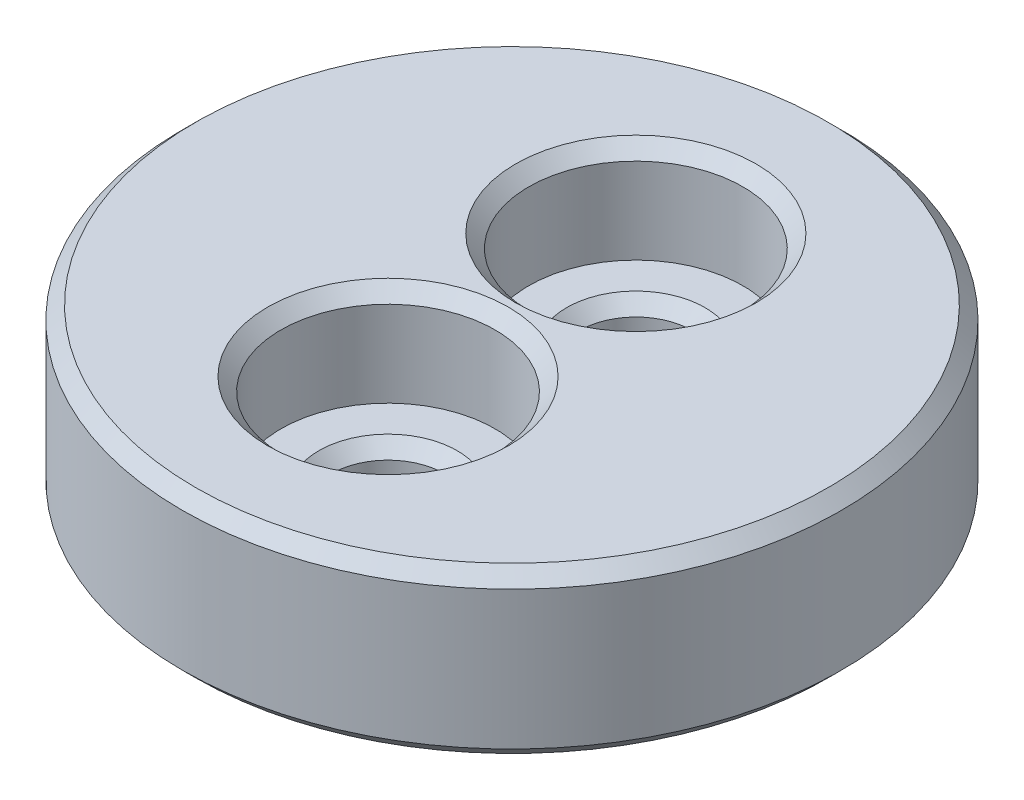
from build123d import *

# Parameters (mm, degrees)
SKETCH1_R                     = 10
BOSS_EXTRUDE1_DEPTH           = 5
CBORE_FOR_M3_SHCS1_AT_2_COUNT = 2
CBORE_FOR_M3_SHCS1_AT_2_PITCH = 7.52
CHAMFER1_SIZE                 = 0.4


with BuildPart() as part:
    # Sketch1 → Boss-Extrude1 (new body)
    with BuildSketch(Plane(origin=(0, 0, 0), x_dir=(1, 0, 0), z_dir=(0, 1, 0))):
        with Locations(Location((0, 0, 0), (0, 0, 270))):
            Circle(SKETCH1_R)
    extrude(amount=BOSS_EXTRUDE1_DEPTH)

    # Sketch3 → CBORE for M3 SHCS1 (revolve, cut)
    with BuildSketch(Plane(origin=(0, 5, -3.76), x_dir=(0, 0, 1), z_dir=(1, 0, 0))):
        Polygon((0, 0), (0, 5), (2.1, 5), (1.7, 4.6), (1.7, 3.4), (2.1, 3), (3.25, 3), (3.25, 0.4), (3.65, 0), align=None)
    cbore_for_m3_shcs1 = revolve(axis=Axis((0, 11.35, -3.76), (0, -1, 0)), mode=Mode.SUBTRACT)

    # CBORE for M3 SHCS1 at 2: CBORE for M3 SHCS1 ×2
    with Locations(*[(0, 0, i * CBORE_FOR_M3_SHCS1_AT_2_PITCH) for i in range(1, CBORE_FOR_M3_SHCS1_AT_2_COUNT)]):
        add(cbore_for_m3_shcs1, mode=Mode.SUBTRACT)

    # Chamfer1
    chamfer1_edges = [part.edges().sort_by_distance(p)[0] for p in [
        (0, 0, -10),
        (0, 5, -10),
    ]]
    chamfer(chamfer1_edges, length=CHAMFER1_SIZE)


solid = part.part
